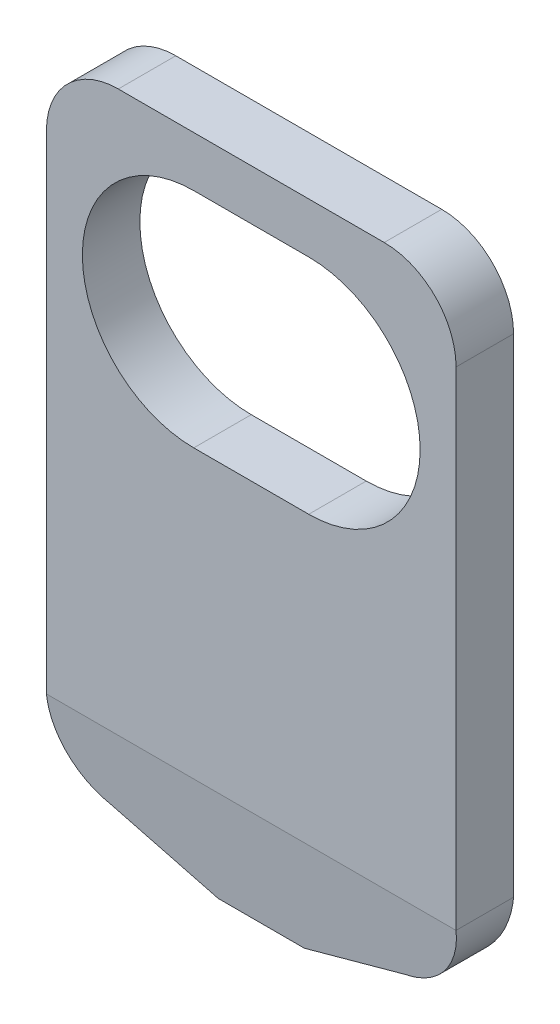
from build123d import *

# Parameters (mm, degrees)
BOSS_EXTRUDE1_DEPTH = 4
CUT_EXTRUDE1_DEPTH  = 55.260943597


with BuildPart() as part:
    # Sketch1 → Boss-Extrude1 (new body)
    with BuildSketch(Plane.XY):
        with BuildLine():
            Line((0, 7.050779416), (0, 41))
            ThreePointArc((0, 41), (1.464466094, 44.535533906), (5, 46))
            Line((5, 46), (23.5, 46))
            ThreePointArc((23.5, 46), (27.035533906, 44.535533906), (28.5, 41))
            Line((28.5, 41), (28.5, 7.050779416))
            ThreePointArc((28.5, 7.050779416), (27.385023171, 3.903305038), (24.537362015, 2.159575061))
            Line((24.537362015, 2.159575061), (17.25, 0))
            Line((17.25, 0), (11.25, 0))
            Line((11.25, 0), (3.962637985, 2.159575061))
            ThreePointArc((3.962637985, 2.159575061), (1.114976829, 3.903305038), (0, 7.050779416))
        make_face()
        with BuildLine():
            Line((10.25, 42.5), (18.25, 42.5))
            ThreePointArc((18.25, 42.5), (26, 34.75), (18.25, 27))
            Line((18.25, 27), (10.25, 27))
            ThreePointArc((10.25, 27), (2.5, 34.75), (10.25, 42.5))
        make_face(mode=Mode.SUBTRACT)
    extrude(amount=BOSS_EXTRUDE1_DEPTH)

    # Sketch2 → Cut-Extrude1 (cut, through all)
    with BuildSketch(Plane.ZY):
        Polygon((0, 0), (0, 7.050779416), (0.7, 0), align=None)
        Polygon((4, 7.050779416), (3.3, 0), (4, 0), align=None)
    extrude(amount=-CUT_EXTRUDE1_DEPTH, mode=Mode.SUBTRACT)


solid = part.part
